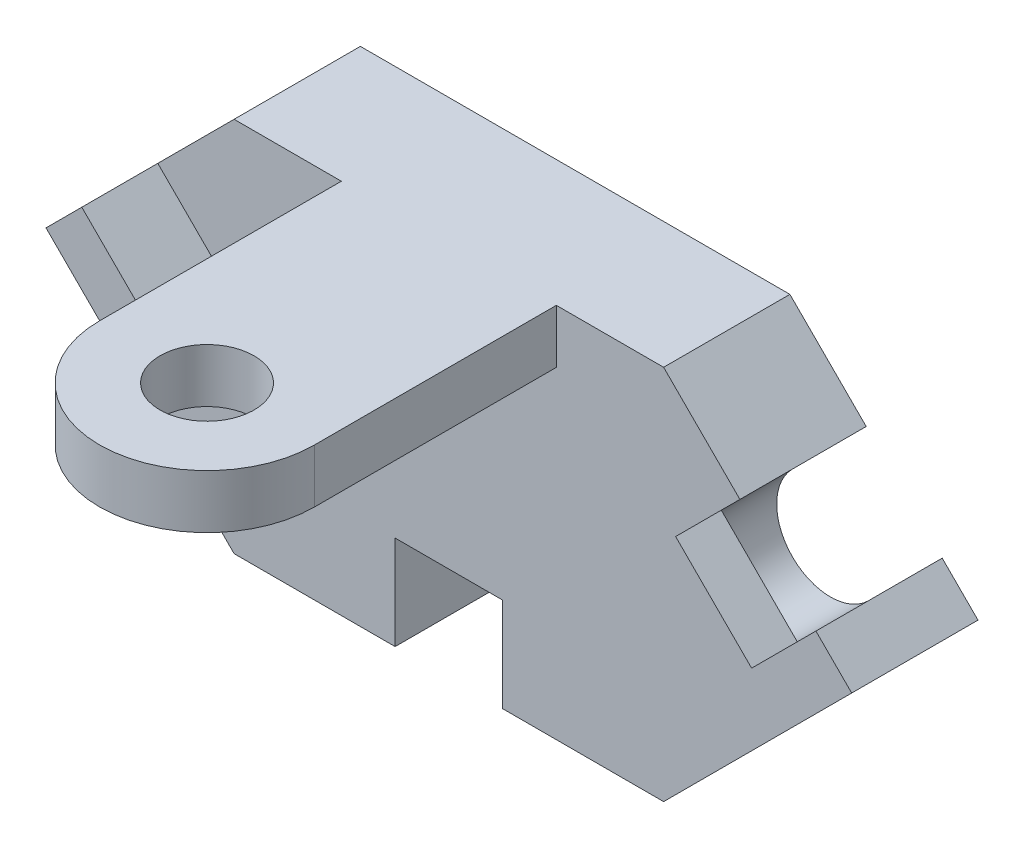
from build123d import *

# Parameters (mm, degrees)
RESSALTO_EXTRUS_O1_DEPTH = 3
RESSALTO_EXTRUS_O2_DEPTH = 1.7
ESBO_O3_R                = 1.75
RESSALTO_EXTRUS_O3_DEPTH = 2


with BuildPart() as part:
    # Esboço1 → Ressalto-extrusão1 (new body)
    with BuildSketch(Plane.XY):
        with BuildLine():
            Line((-7.992880918, 7), (-10.832226897, 4.160654021))
            Line((-10.832226897, 4.160654021), (-8.085786438, 1.414213562))
            ThreePointArc((-8.085786438, 1.414213562), (-8.085786438, -1.414213562), (-10.914213562, -1.414213562))
            Line((-10.914213562, -1.414213562), (-13.660654021, 1.332226897))
            Line((-13.660654021, 1.332226897), (-14.992880918, 0))
            Line((-14.992880918, 0), (-7.992880918, -7))
            Line((-7.992880918, -7), (-2, -7))
            Line((-2, -7), (-2, -3))
            ThreePointArc((-2, -3), (0, -1), (2, -3))
            Line((2, -3), (2, -7))
            Line((2, -7), (7.992880918, -7))
            Line((7.992880918, -7), (14.992880918, 0))
            Line((14.992880918, 0), (13.660654021, 1.332226897))
            Line((13.660654021, 1.332226897), (10.914213562, -1.414213562))
            ThreePointArc((10.914213562, -1.414213562), (8.085786438, -1.414213562), (8.085786438, 1.414213562))
            Line((8.085786438, 1.414213562), (10.832226897, 4.160654021))
            Line((10.832226897, 4.160654021), (7.992880918, 7))
            Line((7.992880918, 7), (-7.992880918, 7))
        make_face()
    extrude(amount=RESSALTO_EXTRUS_O1_DEPTH)

    # Esboço2 → Ressalto-extrusão2 (add)
    with BuildSketch(Plane.XY.offset(3)):
        Polygon((-11.267766953, -1.060660172), (-8.439339828, 1.767766953), (-10.832226897, 4.160654021), (-7.992880918, 7), (7.992880918, 7), (10.832226897, 4.160654021), (8.439339828, 1.767766953), (11.267766953, -1.060660172), (13.660654021, 1.332226897), (14.992880918, 0), (7.992880918, -7), (2, -7), (2, -3.5), (-2, -3.5), (-2, -7), (-7.992880918, -7), (-14.992880918, 0), (-13.660654021, 1.332226897), align=None)
    extrude(amount=RESSALTO_EXTRUS_O2_DEPTH)

    # Esboço3 → Ressalto-extrusão3 (add)
    with BuildSketch(Plane(origin=(0, 7, 0), x_dir=(1, 0, 0), z_dir=(0, 1, 0))):
        with BuildLine():
            Line((4, -13.7), (4, -4.7))
            Line((4, -4.7), (-4, -4.7))
            Line((-4, -4.7), (-4, -13.7))
            ThreePointArc((-4, -13.7), (0, -17.7), (4, -13.7))
        make_face()
        with Locations(Location((0, -13.7, 0), (0, 0, 90))):
            Circle(ESBO_O3_R, mode=Mode.SUBTRACT)
    extrude(amount=-RESSALTO_EXTRUS_O3_DEPTH)


solid = part.part
